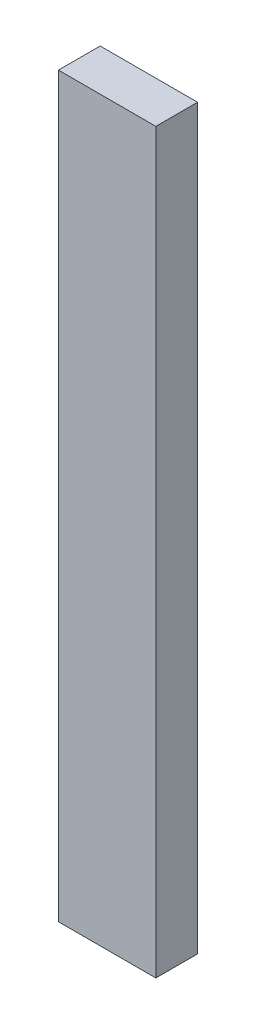
from build123d import *

# Parameters (mm, degrees)
SKETCH1_W           = 88.9
SKETCH1_H           = 673.1
BOSS_EXTRUDE1_DEPTH = 38.1


with BuildPart() as part:
    # Sketch1 → Boss-Extrude1 (new body)
    with BuildSketch(Plane.XY):
        with Locations((-247.65, 812.8)):
            Rectangle(SKETCH1_W, SKETCH1_H)
    extrude(amount=BOSS_EXTRUDE1_DEPTH)


solid = part.part
